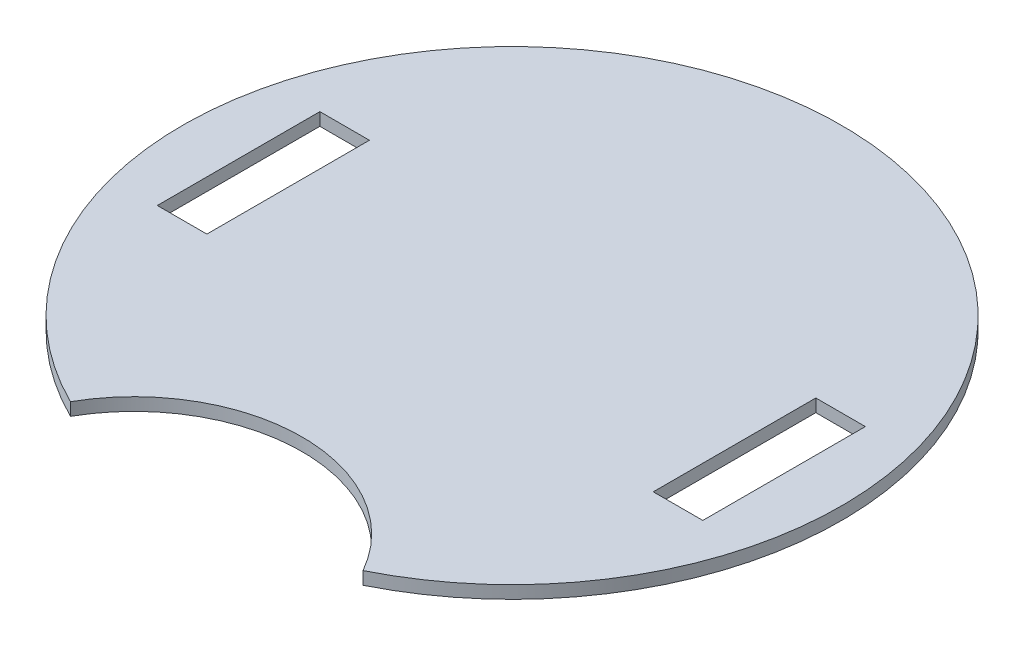
from build123d import *

# Parameters (mm, degrees)
BOSS_EXTRUDE1_DEPTH = 2.9
SKETCH2_W           = 11.27569817
SKETCH2_H           = 36.991766838
CUT_EXTRUDE1_DEPTH  = 107.105654892


with BuildPart() as part:
    # Sketch1 → Boss-Extrude1 (new body)
    with BuildSketch(Plane(origin=(0, 0, 0), x_dir=(1, 0, 0), z_dir=(0, 1, 0))):
        with BuildLine():
            ThreePointArc((33.29110537, -67.206415641), (0, 75), (-33.29110537, -67.206415641))
            ThreePointArc((-33.29110537, -67.206415641), (0, -47.791616815), (33.29110537, -67.206415641))
        make_face()
    extrude(amount=BOSS_EXTRUDE1_DEPTH)

    # Sketch2 → Cut-Extrude1 (cut, through all)
    with BuildSketch(Plane(origin=(0, 2.9, 0), x_dir=(1, 0, 0), z_dir=(0, 1, 0))):
        with Locations((-56.433097695, -0.165843751)):
            Rectangle(SKETCH2_W, SKETCH2_H)
        with Locations((56.433097695, -0.165843751)):
            Rectangle(SKETCH2_W, SKETCH2_H)
    extrude(amount=-CUT_EXTRUDE1_DEPTH, mode=Mode.SUBTRACT)


solid = part.part
